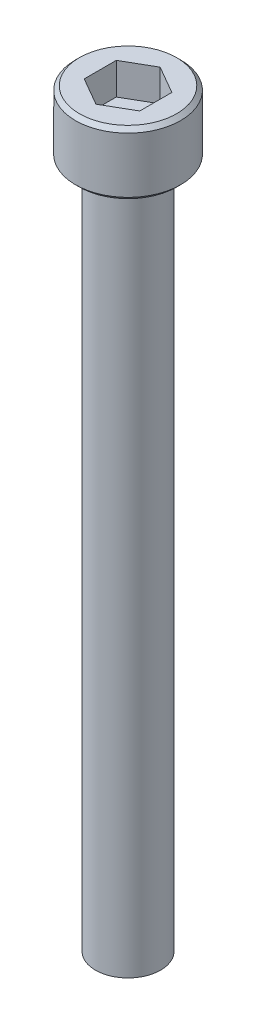
from build123d import *

# Parameters (mm, degrees)
SKETCH1_W           = 3.3655
SKETCH1_H           = 4.064
SKETCH2_R           = 2.0828
BOSS_EXTRUDE1_DEPTH = 44.45
CUT_EXTRUDE1_DEPTH  = 2.032
CHAMFER1_SIZE       = 0.254
CHAMFER2_SIZE       = 0.76962
CHAMFER2_SIZE2      = 0.53848


with BuildPart() as part:
    # Sketch1 → Revolve1 (revolve)
    with BuildSketch(Plane.XY):
        with Locations((1.68275, 2.032)):
            Rectangle(SKETCH1_W, SKETCH1_H)
    revolve(axis=Axis((0, 4.064, 0), (0, -1, 0)))

    # Sketch2 → Boss-Extrude1 (add)
    with BuildSketch(Plane.XZ):
        Circle(SKETCH2_R)
    extrude(amount=BOSS_EXTRUDE1_DEPTH)

    # Sketch3 → Cut-Extrude1 (cut)
    with BuildSketch(Plane(origin=(0, 4.064, 0), x_dir=(-1, 0, 0), z_dir=(0, 1, 0))):
        Polygon((-1.778, -1.026528779), (0, -2.053057557), (1.778, -1.026528779), (1.778, 1.026528779), (0, 2.053057557), (-1.778, 1.026528779), align=None)
    extrude(amount=-CUT_EXTRUDE1_DEPTH, mode=Mode.SUBTRACT)

    # Chamfer1
    chamfer1_edges = [part.edges().sort_by_distance(p)[0] for p in [
        (-3.3655, 0, 0),
        (-3.3655, 4.064, 0),
    ]]
    chamfer(chamfer1_edges, length=CHAMFER1_SIZE)

    # Chamfer2
    chamfer2_edges = [part.edges().sort_by_distance(p)[0] for p in [
        (-2.0828, -44.45, 0),
    ]]
    chamfer2_side = [part.faces().sort_by_distance(p)[0] for p in [
        (0, -44.45, 0),
    ]]
    chamfer(chamfer2_edges, length=CHAMFER2_SIZE, length2=CHAMFER2_SIZE2, reference=chamfer2_side[0])


solid = part.part
